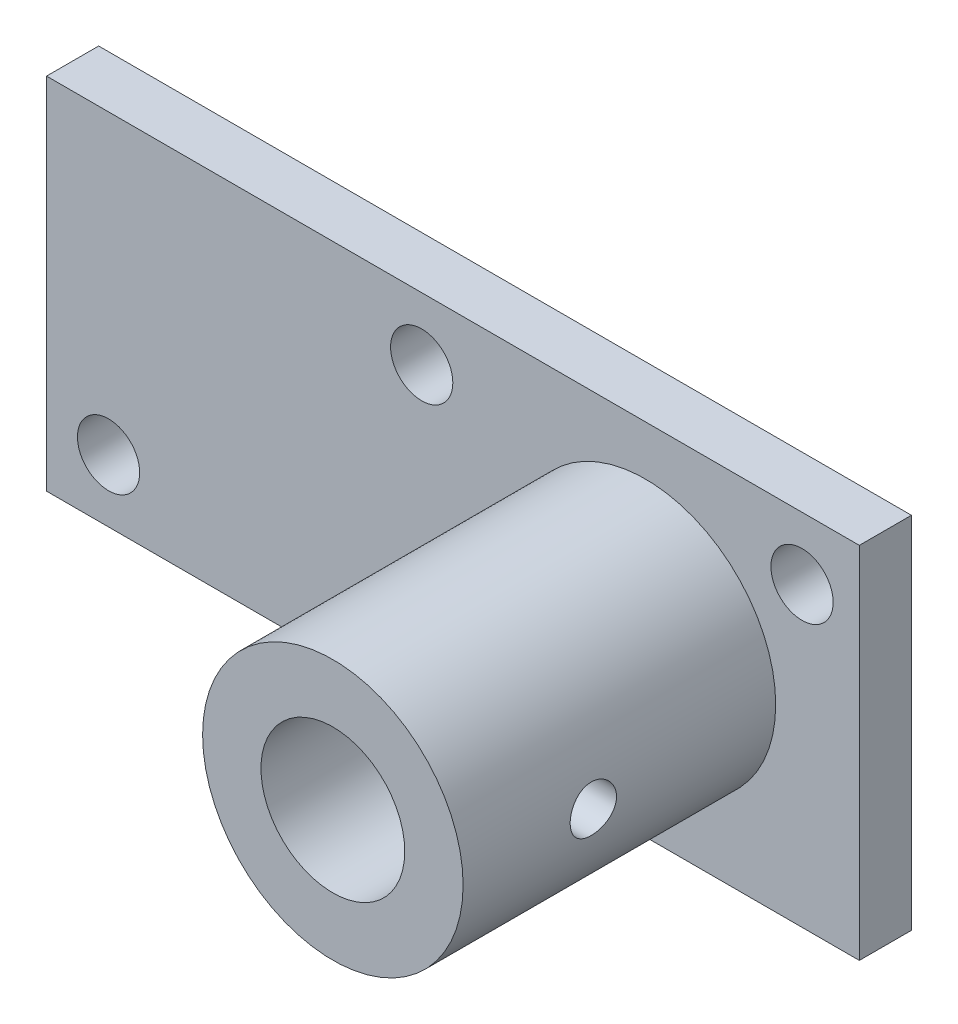
from build123d import *

# Parameters (mm, degrees)
SKETCH1_W               = 39.624
SKETCH1_H               = 17.526
BOSS_EXTRUDE1_DEPTH     = 2.54
SKETCH2_R               = 1.517897845
CUT_EXTRUDE1_DEPTH      = 44.401309335
SKETCH3_R               = 6.35
BOSS_EXTRUDE2_DEPTH     = 15.24
SKETCH5_R               = 3.5052
CUT_EXTRUDE2_DEPTH      = 47.833219535
CUT_EXTRUDE3_REACH      = 45.438
CUT_EXTRUDE3_END_RADIUS = 3.5052
SKETCH6_R               = 1.1303
SKETCH7_R               = 2.38125
CUT_EXTRUDE4_DEPTH      = 1.27


with BuildPart() as part:
    # Sketch1 → Boss-Extrude1 (new body)
    with BuildSketch(Plane.XY):
        with Locations((19.812, -8.763)):
            Rectangle(SKETCH1_W, SKETCH1_H)
    extrude(amount=BOSS_EXTRUDE1_DEPTH)

    # Sketch2 → Cut-Extrude1 (cut, through all)
    with BuildSketch(Plane.XY.offset(2.54)):
        with Locations((36.83, -3.048)):
            Circle(SKETCH2_R)
        with Locations((21.5646, -14.478)):
            Circle(SKETCH2_R)
        with Locations((18.288, -3.048)):
            Circle(SKETCH2_R)
        with Locations((3.0226, -14.478)):
            Circle(SKETCH2_R)
    extrude(amount=-CUT_EXTRUDE1_DEPTH, mode=Mode.SUBTRACT)

    # Sketch3 → Boss-Extrude2 (add)
    with BuildSketch(Plane.XY.offset(2.54)):
        with Locations(Location((29.1973, -8.763, 0), (0, 0, 180))):
            Circle(SKETCH3_R)
    extrude(amount=BOSS_EXTRUDE2_DEPTH)

    # Sketch5 → Cut-Extrude2 (cut, through all)
    with BuildSketch(Plane.XY.offset(17.78)):
        with Locations((29.1973, -8.763)):
            Circle(SKETCH5_R)
    extrude(amount=-CUT_EXTRUDE2_DEPTH, mode=Mode.SUBTRACT)

    # Cut-Extrude3: up to this cylinder (the profile starts outside it)
    cut_extrude3_end = Plane(origin=(29.1973, -8.763, 11.43), z_dir=(0, 0, 1)) * Cylinder(CUT_EXTRUDE3_END_RADIUS, 98.8864, mode=Mode.PRIVATE)
    # Sketch6 → Cut-Extrude3 (cut, up to the surface)
    with BuildSketch(Plane(origin=(35.5473, 0, 0), x_dir=(0, 0, -1), z_dir=(1, 0, 0)), mode=Mode.PRIVATE) as cut_extrude3_sk1:
        with Locations((-11.43, -8.763)):
            Circle(SKETCH6_R)
    cut_extrude3_tool1 = extrude(cut_extrude3_sk1.sketch, amount=-CUT_EXTRUDE3_REACH, mode=Mode.PRIVATE) - cut_extrude3_end
    add(cut_extrude3_tool1.solids().sort_by_distance((35.5473, -8.763, 11.43))[0], mode=Mode.SUBTRACT)

    # Sketch7 → Cut-Extrude4 (cut)
    with BuildSketch(Plane(origin=(0, 0, 0), x_dir=(-1, 0, 0), z_dir=(0, 0, -1))):
        with Locations((-15.748, -14.224)):
            Circle(SKETCH7_R)
        with Locations((-5.715, -3.556)):
            Circle(SKETCH7_R)
        with Locations((-23.368, -3.556)):
            Circle(SKETCH7_R)
        with Locations((-33.274, -14.224)):
            Circle(SKETCH7_R)
    extrude(amount=-CUT_EXTRUDE4_DEPTH, mode=Mode.SUBTRACT)


solid = part.part
